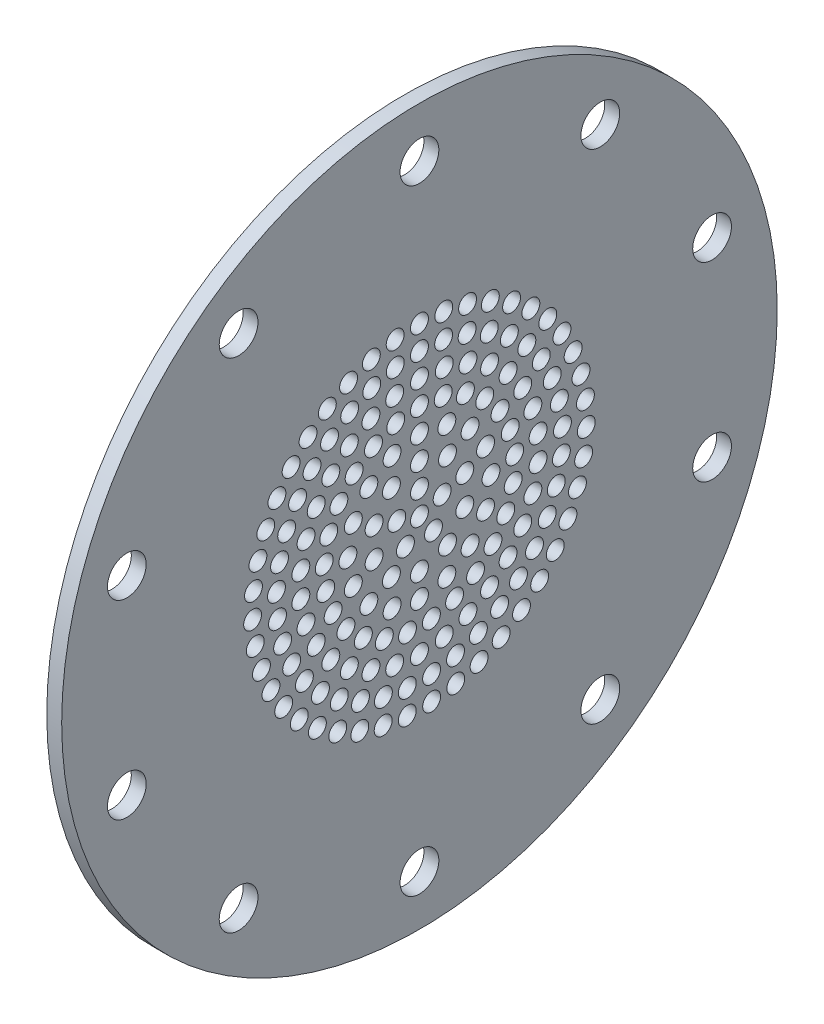
from build123d import *

# Parameters (mm, degrees)
SKETCH3_R          = 1.5
CUT_EXTRUDE6_DEPTH = 10
SKETCH4_R          = 3.25
CUT_EXTRUDE7_DEPTH = 10


with BuildPart() as part:
    # Sketch2 → Revolve1 (revolve)
    with BuildSketch(Plane.XY, mode=Mode.PRIVATE) as revolve1_sk:
        Polygon((2.5, 0), (2.5, 31), (2.5, 60), (0, 60), (0, 0), align=None)
    revolve(revolve1_sk.sketch.rotate(Axis((0, 0, 0), (1, 0, 0)), 90), axis=Axis((0, 0, 0), (1, 0, 0)))

    # Sketch3 → Cut-Extrude6 (cut)
    with BuildSketch(Plane.ZY):
        with Locations((4.592201188, 11.08655439)):
            Circle(SKETCH3_R)
        Circle(SKETCH3_R)
        with Locations((0, 4)):
            Circle(SKETCH3_R)
        with Locations((0, 8)):
            Circle(SKETCH3_R)
        with Locations((0, 12)):
            Circle(SKETCH3_R)
        with Locations((0, 16)):
            Circle(SKETCH3_R)
        with Locations((0, 20)):
            Circle(SKETCH3_R)
        with Locations((3.979038195, 15.497330578)):
            Circle(SKETCH3_R)
        with Locations((4.158233816, 19.562952015)):
            Circle(SKETCH3_R)
        with Locations((8.485281374, 8.485281374)):
            Circle(SKETCH3_R)
        with Locations((7.708058786, 14.020906881)):
            Circle(SKETCH3_R)
        with Locations((8.134732862, 18.270909153)):
            Circle(SKETCH3_R)
        with Locations((11.08655439, 4.592201188)):
            Circle(SKETCH3_R)
        with Locations((10.952753695, 11.663498039)):
            Circle(SKETCH3_R)
        with Locations((11.755705046, 16.180339887)):
            Circle(SKETCH3_R)
        with Locations((12, 0)):
            Circle(SKETCH3_R)
        with Locations((13.509246808, 8.57322872)):
            Circle(SKETCH3_R)
        with Locations((14.86289651, 13.382612127)):
            Circle(SKETCH3_R)
        with Locations((11.08655439, -4.592201188)):
            Circle(SKETCH3_R)
        with Locations((15.216904261, 4.94427191)):
            Circle(SKETCH3_R)
        with Locations((17.320508076, 10)):
            Circle(SKETCH3_R)
        with Locations((8.485281374, -8.485281374)):
            Circle(SKETCH3_R)
        with Locations((15.968427655, 1.004648312)):
            Circle(SKETCH3_R)
        with Locations((19.021130326, 6.180339887)):
            Circle(SKETCH3_R)
        with Locations((4.592201188, -11.08655439)):
            Circle(SKETCH3_R)
        with Locations((15.716596012, -2.998101033)):
            Circle(SKETCH3_R)
        with Locations((19.890437907, 2.090569265)):
            Circle(SKETCH3_R)
        with Locations((0, -12)):
            Circle(SKETCH3_R)
        with Locations((14.477232839, -6.812468665)):
            Circle(SKETCH3_R)
        with Locations((19.890437907, -2.090569265)):
            Circle(SKETCH3_R)
        with Locations((-4.592201188, -11.08655439)):
            Circle(SKETCH3_R)
        with Locations((12.328211884, -10.198783836)):
            Circle(SKETCH3_R)
        with Locations((19.021130326, -6.180339887)):
            Circle(SKETCH3_R)
        with Locations((-8.485281374, -8.485281374)):
            Circle(SKETCH3_R)
        with Locations((9.404564037, -12.94427191)):
            Circle(SKETCH3_R)
        with Locations((17.320508076, -10)):
            Circle(SKETCH3_R)
        with Locations((-11.08655439, -4.592201188)):
            Circle(SKETCH3_R)
        with Locations((5.889992843, -14.876423774)):
            Circle(SKETCH3_R)
        with Locations((14.86289651, -13.382612127)):
            Circle(SKETCH3_R)
        with Locations((-12, 0)):
            Circle(SKETCH3_R)
        with Locations((2.005331737, -15.873835221)):
            Circle(SKETCH3_R)
        with Locations((11.755705046, -16.180339887)):
            Circle(SKETCH3_R)
        with Locations((-11.08655439, 4.592201188)):
            Circle(SKETCH3_R)
        with Locations((-2.005331737, -15.873835221)):
            Circle(SKETCH3_R)
        with Locations((8.134732862, -18.270909153)):
            Circle(SKETCH3_R)
        with Locations((-8.485281374, 8.485281374)):
            Circle(SKETCH3_R)
        with Locations((-5.889992843, -14.876423774)):
            Circle(SKETCH3_R)
        with Locations((4.158233816, -19.562952015)):
            Circle(SKETCH3_R)
        with Locations((-4.592201188, 11.08655439)):
            Circle(SKETCH3_R)
        with Locations((-9.404564037, -12.94427191)):
            Circle(SKETCH3_R)
        with Locations((0, -20)):
            Circle(SKETCH3_R)
        with Locations((4.702282018, 6.472135955)):
            Circle(SKETCH3_R)
        with Locations((7.60845213, 2.472135955)):
            Circle(SKETCH3_R)
        with Locations((7.60845213, -2.472135955)):
            Circle(SKETCH3_R)
        with Locations((4.702282018, -6.472135955)):
            Circle(SKETCH3_R)
        with Locations((0, -8)):
            Circle(SKETCH3_R)
        with Locations((-4.702282018, -6.472135955)):
            Circle(SKETCH3_R)
        with Locations((-7.60845213, -2.472135955)):
            Circle(SKETCH3_R)
        with Locations((-7.60845213, 2.472135955)):
            Circle(SKETCH3_R)
        with Locations((-4.702282018, 6.472135955)):
            Circle(SKETCH3_R)
        with Locations((3.804226065, 1.236067978)):
            Circle(SKETCH3_R)
        with Locations((2.351141009, -3.236067977)):
            Circle(SKETCH3_R)
        with Locations((-2.351141009, -3.236067977)):
            Circle(SKETCH3_R)
        with Locations((-3.804226065, 1.236067977)):
            Circle(SKETCH3_R)
        with Locations((-12.328211884, -10.198783836)):
            Circle(SKETCH3_R)
        with Locations((-4.158233816, -19.562952015)):
            Circle(SKETCH3_R)
        with Locations((-14.477232839, -6.812468665)):
            Circle(SKETCH3_R)
        with Locations((-8.134732862, -18.270909153)):
            Circle(SKETCH3_R)
        with Locations((-15.716596012, -2.998101033)):
            Circle(SKETCH3_R)
        with Locations((-11.755705046, -16.180339887)):
            Circle(SKETCH3_R)
        with Locations((-15.968427655, 1.004648312)):
            Circle(SKETCH3_R)
        with Locations((-14.86289651, -13.382612127)):
            Circle(SKETCH3_R)
        with Locations((-15.216904261, 4.94427191)):
            Circle(SKETCH3_R)
        with Locations((-17.320508076, -10)):
            Circle(SKETCH3_R)
        with Locations((-13.509246808, 8.57322872)):
            Circle(SKETCH3_R)
        with Locations((-19.021130326, -6.180339887)):
            Circle(SKETCH3_R)
        with Locations((-10.952753695, 11.663498039)):
            Circle(SKETCH3_R)
        with Locations((-19.890437907, -2.090569265)):
            Circle(SKETCH3_R)
        with Locations((-7.708058786, 14.020906881)):
            Circle(SKETCH3_R)
        with Locations((-19.890437907, 2.090569265)):
            Circle(SKETCH3_R)
        with Locations((-3.979038195, 15.497330578)):
            Circle(SKETCH3_R)
        with Locations((-19.021130326, 6.180339887)):
            Circle(SKETCH3_R)
        with Locations((0, 24)):
            Circle(SKETCH3_R)
        with Locations((0, 28)):
            Circle(SKETCH3_R)
        with Locations((-17.320508076, 10)):
            Circle(SKETCH3_R)
        with Locations((-14.86289651, 13.382612127)):
            Circle(SKETCH3_R)
        with Locations((-11.755705046, 16.180339887)):
            Circle(SKETCH3_R)
        with Locations((-8.134732862, 18.270909153)):
            Circle(SKETCH3_R)
        with Locations((-4.158233816, 19.562952015)):
            Circle(SKETCH3_R)
        with Locations((4.056019688, 23.654781848)):
            Circle(SKETCH3_R)
        with Locations((7.995355074, 22.629058691)):
            Circle(SKETCH3_R)
        with Locations((11.704678652, 20.952338716)):
            Circle(SKETCH3_R)
        with Locations((15.077279935, 18.672858104)):
            Circle(SKETCH3_R)
        with Locations((18.016135326, 15.856193361)):
            Circle(SKETCH3_R)
        with Locations((20.436699306, 12.583374805)):
            Circle(SKETCH3_R)
        with Locations((22.269336655, 8.948555467)):
            Circle(SKETCH3_R)
        with Locations((23.461325735, 5.05630248)):
            Circle(SKETCH3_R)
        with Locations((23.978375189, 1.018588877)):
            Circle(SKETCH3_R)
        with Locations((23.805610446, -3.048427674)):
            Circle(SKETCH3_R)
        with Locations((22.948001634, -7.027746511)):
            Circle(SKETCH3_R)
        with Locations((21.430220596, -10.804889876)):
            Circle(SKETCH3_R)
        with Locations((19.295931129, -14.271196231)):
            Circle(SKETCH3_R)
        with Locations((16.606532855, -17.326946255)):
            Circle(SKETCH3_R)
        with Locations((13.439394867, -19.884231582)):
            Circle(SKETCH3_R)
        with Locations((9.885629958, -21.869483769)):
            Circle(SKETCH3_R)
        with Locations((6.047473473, -23.225590726)):
            Circle(SKETCH3_R)
        with Locations((2.035342187, -23.913539725)):
            Circle(SKETCH3_R)
        with Locations((-2.035342187, -23.913539725)):
            Circle(SKETCH3_R)
        with Locations((-6.047473473, -23.225590726)):
            Circle(SKETCH3_R)
        with Locations((-9.885629958, -21.869483769)):
            Circle(SKETCH3_R)
        with Locations((-13.439394867, -19.884231582)):
            Circle(SKETCH3_R)
        with Locations((-16.606532855, -17.326946255)):
            Circle(SKETCH3_R)
        with Locations((-19.295931129, -14.271196231)):
            Circle(SKETCH3_R)
        with Locations((-21.430220596, -10.804889876)):
            Circle(SKETCH3_R)
        with Locations((-22.948001634, -7.027746511)):
            Circle(SKETCH3_R)
        with Locations((-23.805610446, -3.048427674)):
            Circle(SKETCH3_R)
        with Locations((-23.978375189, 1.018588877)):
            Circle(SKETCH3_R)
        with Locations((-23.461325735, 5.05630248)):
            Circle(SKETCH3_R)
        with Locations((-22.269336655, 8.948555467)):
            Circle(SKETCH3_R)
        with Locations((-20.436699306, 12.583374805)):
            Circle(SKETCH3_R)
        with Locations((-18.016135326, 15.856193361)):
            Circle(SKETCH3_R)
        with Locations((-15.077279935, 18.672858104)):
            Circle(SKETCH3_R)
        with Locations((-11.704678652, 20.952338716)):
            Circle(SKETCH3_R)
        with Locations((-7.995355074, 22.629058691)):
            Circle(SKETCH3_R)
        with Locations((-4.056019688, 23.654781848)):
            Circle(SKETCH3_R)
        with Locations((4.076832697, 27.701614306)):
            Circle(SKETCH3_R)
        with Locations((8.066774782, 26.812816797)):
            Circle(SKETCH3_R)
        with Locations((11.884787569, 25.35255065)):
            Circle(SKETCH3_R)
        with Locations((15.449496742, 23.351938901)):
            Circle(SKETCH3_R)
        with Locations((18.684926714, 20.853621117)):
            Circle(SKETCH3_R)
        with Locations((21.522119914, 17.910844604)):
            Circle(SKETCH3_R)
        with Locations((23.900606493, 14.586329534)):
            Circle(SKETCH3_R)
        with Locations((25.76969314, 10.950932174)):
            Circle(SKETCH3_R)
        with Locations((27.089543518, 7.082134707)):
            Circle(SKETCH3_R)
        with Locations((27.832027307, 3.062393835)):
            Circle(SKETCH3_R)
        with Locations((27.981319754, -1.022616646)):
            Circle(SKETCH3_R)
        with Locations((27.534238951, -5.085831827)):
            Circle(SKETCH3_R)
        with Locations((26.500313648, -9.040651334)):
            Circle(SKETCH3_R)
        with Locations((24.901580169, -12.802785053)):
            Circle(SKETCH3_R)
        with Locations((22.772112741, -16.292049636)):
            Circle(SKETCH3_R)
        with Locations((20.157297265, -19.434077466)):
            Circle(SKETCH3_R)
        with Locations((17.112863995, -22.161901676)):
            Circle(SKETCH3_R)
        with Locations((13.703699739, -24.417383428)):
            Circle(SKETCH3_R)
        with Locations((10.002464914, -26.152451045)):
            Circle(SKETCH3_R)
        with Locations((6.088044916, -27.330124572)):
            Circle(SKETCH3_R)
        with Locations((2.043868811, -27.925303943)):
            Circle(SKETCH3_R)
        with Locations((-2.043868811, -27.925303943)):
            Circle(SKETCH3_R)
        with Locations((-6.088044916, -27.330124572)):
            Circle(SKETCH3_R)
        with Locations((-10.002464914, -26.152451045)):
            Circle(SKETCH3_R)
        with Locations((-13.703699739, -24.417383428)):
            Circle(SKETCH3_R)
        with Locations((-17.112863995, -22.161901676)):
            Circle(SKETCH3_R)
        with Locations((-20.157297265, -19.434077466)):
            Circle(SKETCH3_R)
        with Locations((-22.772112741, -16.292049636)):
            Circle(SKETCH3_R)
        with Locations((-24.901580169, -12.802785053)):
            Circle(SKETCH3_R)
        with Locations((-26.500313648, -9.040651334)):
            Circle(SKETCH3_R)
        with Locations((-27.534238951, -5.085831827)):
            Circle(SKETCH3_R)
        with Locations((-27.981319754, -1.022616646)):
            Circle(SKETCH3_R)
        with Locations((-27.832027307, 3.062393835)):
            Circle(SKETCH3_R)
        with Locations((-27.089543518, 7.082134707)):
            Circle(SKETCH3_R)
        with Locations((-25.76969314, 10.950932174)):
            Circle(SKETCH3_R)
        with Locations((-23.900606493, 14.586329534)):
            Circle(SKETCH3_R)
        with Locations((-21.522119914, 17.910844604)):
            Circle(SKETCH3_R)
        with Locations((-18.684926714, 20.853621117)):
            Circle(SKETCH3_R)
        with Locations((-15.449496742, 23.351938901)):
            Circle(SKETCH3_R)
        with Locations((-11.884787569, 25.35255065)):
            Circle(SKETCH3_R)
        with Locations((-8.066774782, 26.812816797)):
            Circle(SKETCH3_R)
        with Locations((-4.076832697, 27.701614306)):
            Circle(SKETCH3_R)
    extrude(amount=-CUT_EXTRUDE6_DEPTH, mode=Mode.SUBTRACT)

    # Sketch4 → Cut-Extrude7 (cut)
    with BuildSketch(Plane.ZY):
        with Locations((0, 51.6)):
            Circle(SKETCH4_R)
        with Locations((30.329719018, 41.74527691)):
            Circle(SKETCH4_R)
        with Locations((49.074516241, 15.94527691)):
            Circle(SKETCH4_R)
        with Locations((49.074516241, -15.94527691)):
            Circle(SKETCH4_R)
        with Locations((30.329719018, -41.74527691)):
            Circle(SKETCH4_R)
        with Locations((0, -51.6)):
            Circle(SKETCH4_R)
        with Locations((-30.329719018, -41.74527691)):
            Circle(SKETCH4_R)
        with Locations((-49.074516241, -15.94527691)):
            Circle(SKETCH4_R)
        with Locations((-49.074516241, 15.94527691)):
            Circle(SKETCH4_R)
        with Locations((-30.329719018, 41.74527691)):
            Circle(SKETCH4_R)
    extrude(amount=-CUT_EXTRUDE7_DEPTH, mode=Mode.SUBTRACT)


solid = part.part
